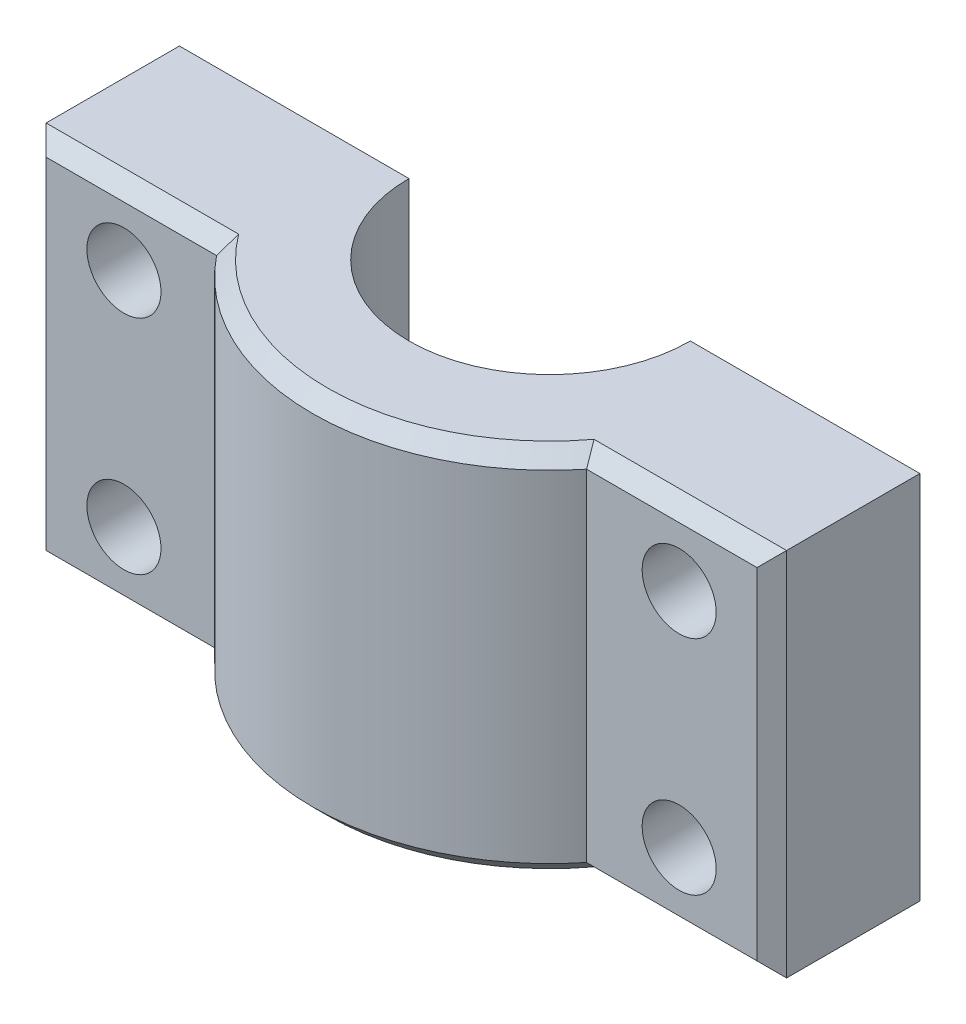
from build123d import *

# Parameters (mm, degrees)
SKETCH_1_R          = 8
EXTRUDE_1_DEPTH     = 12.5
SKETCH_3_W          = 25
SKETCH_3_H          = 10
EXTRUDE_2_DEPTH     = 12.5
SKETCH_4_R          = 4.75
CUT_EXTRUDE_1_DEPTH = 20.403607912
SKETCH_5_R          = 1.25
CUT_EXTRUDE_2_DEPTH = 22.943108257
CHAMFER_1_SIZE      = 0.5
SKETCH_6_W          = 49.161013252
SKETCH_6_H          = 46.40097955
CUT_EXTRUDE_3_DEPTH = 20.403607912


with BuildPart() as part:
    # 草图1 → 凸台-拉伸1 (new body)
    with BuildSketch(Plane(origin=(0, 0, 0), x_dir=(1, 0, 0), z_dir=(0, 1, 0))):
        with Locations(Location((0, 0, 0), (0, 0, 270))):
            Circle(SKETCH_1_R)
    extrude(amount=EXTRUDE_1_DEPTH)

    # 草图3 → 凸台-拉伸2 (add)
    with BuildSketch(Plane(origin=(0, 12.5, 0), x_dir=(1, 0, 0), z_dir=(0, 1, 0))):
        Rectangle(SKETCH_3_W, SKETCH_3_H)
    extrude(amount=-EXTRUDE_2_DEPTH)

    # 草图4 → 切除-拉伸1 (cut, through all)
    with BuildSketch(Plane(origin=(0, 12.5, 0), x_dir=(1, 0, 0), z_dir=(0, 1, 0))):
        with Locations(Location((0, 0, 0), (0, 0, 270))):
            Circle(SKETCH_4_R)
    extrude(amount=-CUT_EXTRUDE_1_DEPTH, mode=Mode.SUBTRACT)

    # 草图5 → 切除-拉伸2 (cut, through all)
    with BuildSketch(Plane(origin=(0, 0, -5), x_dir=(-1, 0, 0), z_dir=(0, 0, -1))):
        with Locations((9.372498999, 2.5)):
            Circle(SKETCH_5_R)
        with Locations((9.372498999, 10)):
            Circle(SKETCH_5_R)
    cut_extrude_2 = extrude(amount=-CUT_EXTRUDE_2_DEPTH, mode=Mode.SUBTRACT)

    # 镜向1: 切除-拉伸2 across plane
    add(cut_extrude_2.mirror(Plane(origin=(0, 0, 0), x_dir=(0, 0, 1), z_dir=(1, 0, 0))), mode=Mode.SUBTRACT)

    # 倒角1
    chamfer_1_edges = [part.edges().sort_by_distance(p)[0] for p in [
        (9.372498999, 12.5, -5),
        (9.372498999, 12.5, 5),
        (9.372498999, 0, 5),
        (9.372498999, 0, -5),
        (-12.5, 6.25, -5),
        (12.5, 6.25, 5),
        (-12.5, 6.25, 5),
        (12.5, 6.25, -5),
        (-9.372498999, 12.5, 5),
        (-9.372498999, 12.5, -5),
        (-9.372498999, 0, -5),
        (-9.372498999, 0, 5),
        (0, 0, -8),
        (0, 0, 8),
        (0, 12.5, -8),
        (0, 12.5, 8),
    ]]
    chamfer(chamfer_1_edges, length=CHAMFER_1_SIZE)

    # 草图6 → 切除-拉伸3 (cut, through all)
    with BuildSketch(Plane.XY):
        Rectangle(SKETCH_6_W, SKETCH_6_H)
    extrude(amount=-CUT_EXTRUDE_3_DEPTH, mode=Mode.SUBTRACT)


solid = part.part
